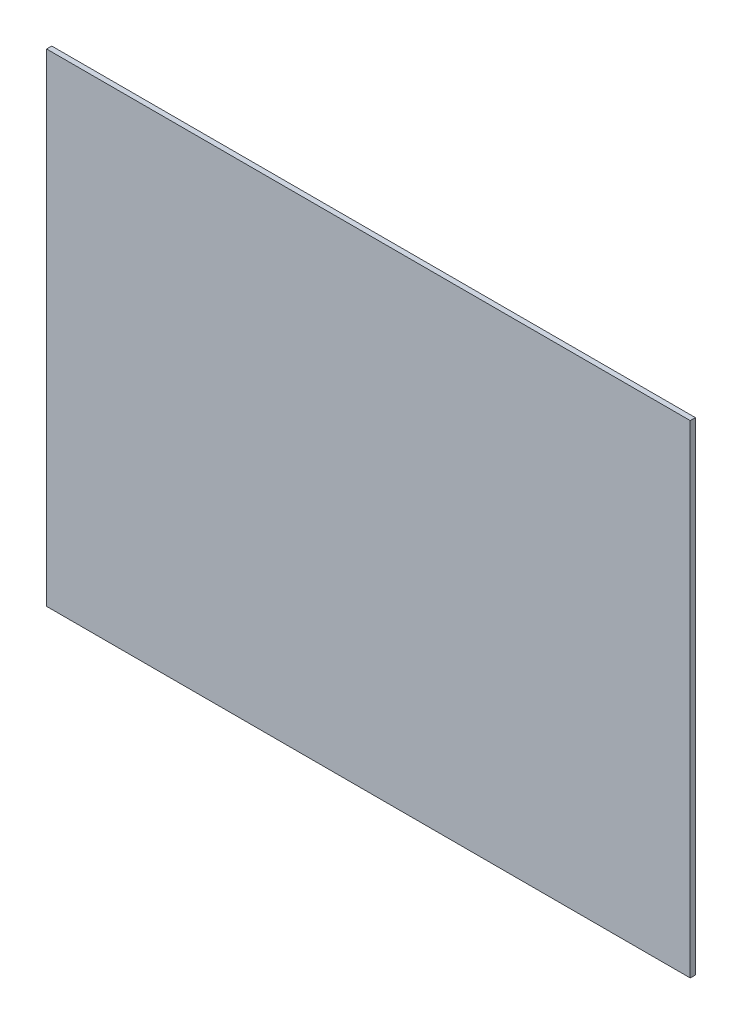
from build123d import *

# Parameters (mm, degrees)
SKIZZE2_W                       = 2000
SKIZZE2_H                       = 1500
AUFSATZ_LINEAR_AUSTRAGEN1_DEPTH = 16


with BuildPart() as part:
    # Skizze2 → Aufsatz-Linear austragen1 (new body)
    with BuildSketch(Plane.XY):
        Rectangle(SKIZZE2_W, SKIZZE2_H)
    extrude(amount=AUFSATZ_LINEAR_AUSTRAGEN1_DEPTH)


solid = part.part
